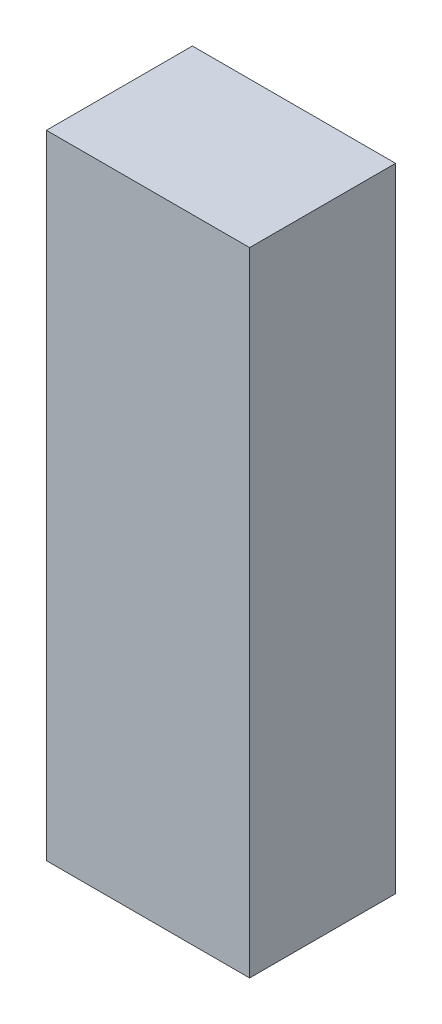
from build123d import *

# Parameters (mm, degrees)
SKETCH1_W           = 35.5
SKETCH1_H           = 110.5
BOSS_EXTRUDE1_DEPTH = 25.5


with BuildPart() as part:
    # Sketch1 → Boss-Extrude1 (new body)
    with BuildSketch(Plane.XY):
        with Locations((15.312865678, 78.228457255)):
            Rectangle(SKETCH1_W, SKETCH1_H)
    extrude(amount=BOSS_EXTRUDE1_DEPTH)


solid = part.part
